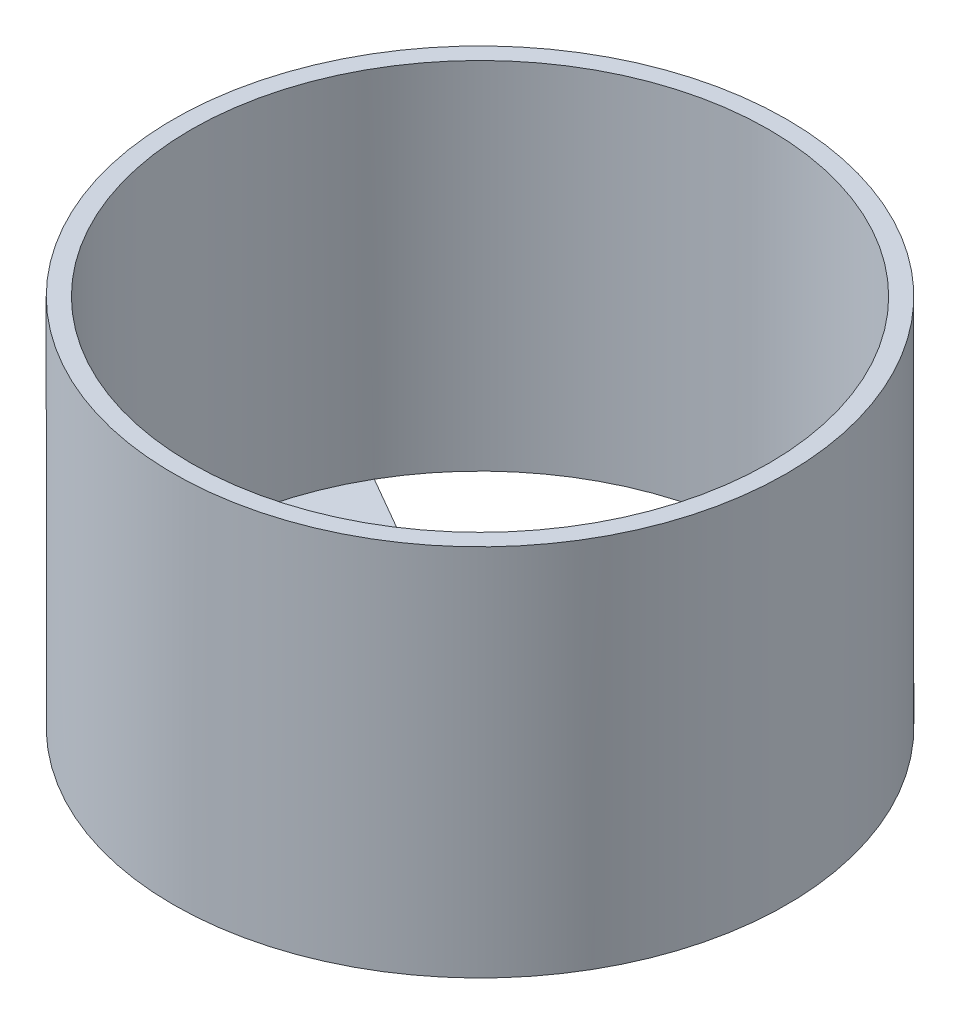
from build123d import *

# Parameters (mm, degrees)
SKETCH1_R           = 43.815
SKETCH1_R_2         = 41.275
EXTRUDE_THIN1_DEPTH = 50.8
BOSS_EXTRUDE1_START = 2.54
BOSS_EXTRUDE1_DEPTH = 2.54


with BuildPart() as part:
    # Sketch1 → Extrude-Thin1 (new body)
    with BuildSketch(Plane(origin=(0, 0, 0), x_dir=(1, 0, 0), z_dir=(0, 1, 0))):
        Circle(SKETCH1_R)
        Circle(SKETCH1_R_2, mode=Mode.SUBTRACT)
    extrude(amount=EXTRUDE_THIN1_DEPTH)

    # Sketch2 → Boss-Extrude1 (add)
    with BuildSketch(Plane.XZ.offset(BOSS_EXTRUDE1_START)):
        with BuildLine():
            Line((0, -43.815), (0, 0))
            Line((0, 0), (-37.944903067, -21.9075))
            ThreePointArc((-37.944903067, -21.9075), (21.9075, 37.944903067), (0, -43.815))
        make_face()
    extrude(amount=-BOSS_EXTRUDE1_DEPTH)


solid = part.part
